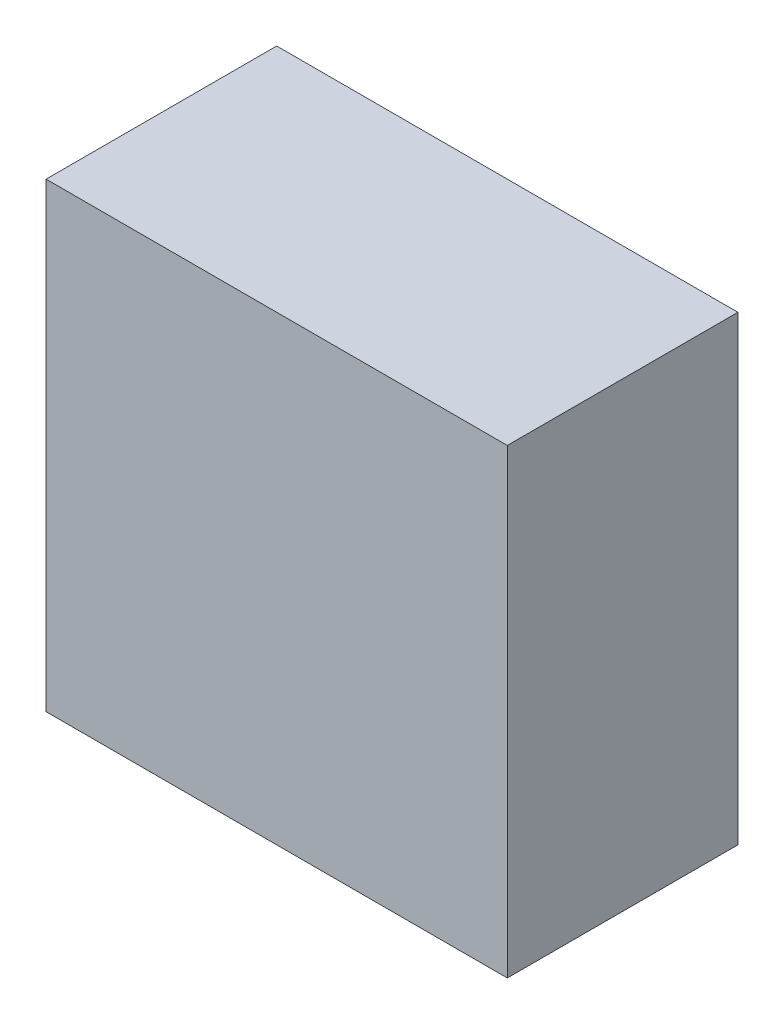
from build123d import *

# Parameters (mm, degrees)
SKETCH1_W           = 200
SKETCH1_H           = 200
BOSS_EXTRUDE1_DEPTH = 100


with BuildPart() as part:
    # Sketch1 → Boss-Extrude1 (new body)
    with BuildSketch(Plane.XY):
        with Locations((-100, 100)):
            Rectangle(SKETCH1_W, SKETCH1_H)
    extrude(amount=BOSS_EXTRUDE1_DEPTH)


solid = part.part
